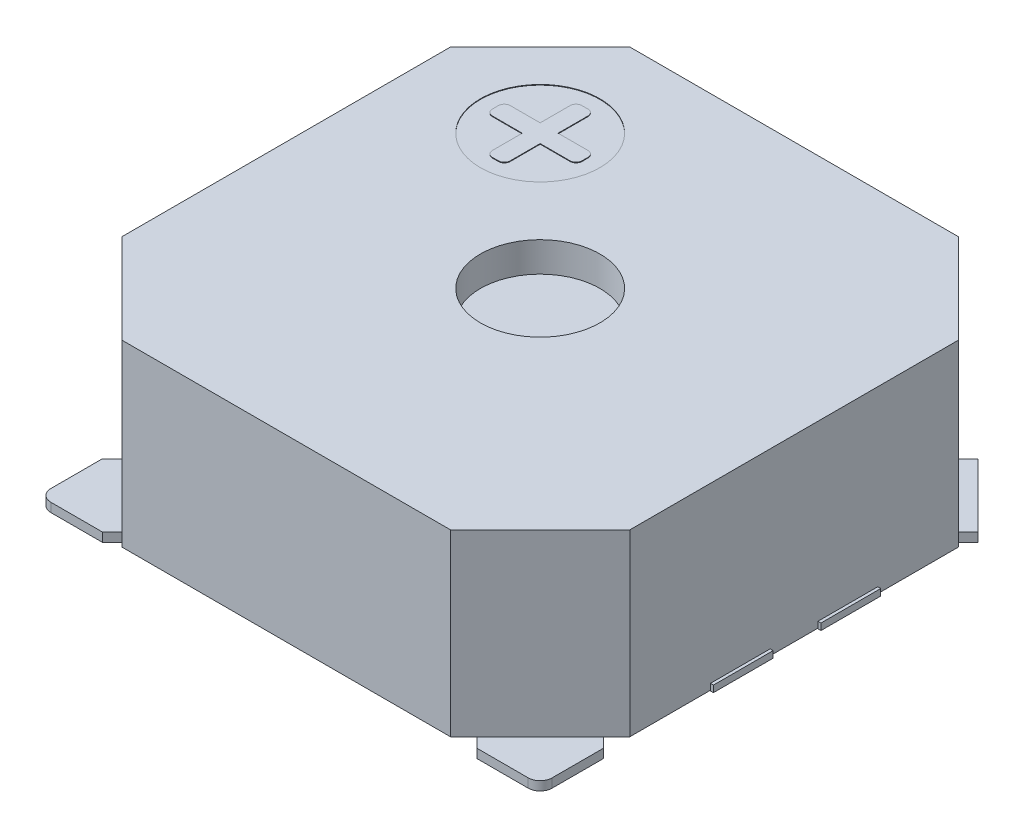
from build123d import *

# Parameters (mm, degrees)
SKETCH1_W                = 8.5
SKETCH1_H                = 8.5
BOSS_EXTRUDE1_DEPTH      = 3
CUT_EXTRUDE1_DEPTH       = 3
SHELL2_T                 = 0.5
SKETCH3_R                = 1
CUT_EXTRUDE2_DEPTH       = 0.5
BOSS_EXTRUDE2_DEPTH      = 0.15
SKETCH5_R                = 1
CUT_EXTRUDE3_DEPTH       = 0.01
BOSS_EXTRUDE3_DEPTH      = 0.01
BOSS_EXTRUDE3_DEPTH_BACK = 0.1
SKETCH6_W                = 1
SKETCH6_H                = 1
SKETCH7_R                = 0.25
CUT_EXTRUDE4_DEPTH       = 0.1


with BuildPart() as part:
    # Sketch1 → Boss-Extrude1 (new body)
    with BuildSketch(Plane(origin=(0, 0, 0), x_dir=(1, 0, 0), z_dir=(0, 1, 0))):
        Rectangle(SKETCH1_W, SKETCH1_H)
    extrude(amount=BOSS_EXTRUDE1_DEPTH)

    # Sketch2 → Cut-Extrude1 (cut)
    with BuildSketch(Plane(origin=(0, 3, 0), x_dir=(1, 0, 0), z_dir=(0, 1, 0))):
        Polygon((-4.25, 2.75), (-2.75, 4.25), (-4.25, 4.25), align=None)
        Polygon((4.25, 4.25), (4.25, 2.75), (2.75, 4.25), align=None)
        Polygon((4.25, -2.75), (2.75, -4.25), (4.25, -4.25), align=None)
        Polygon((-4.25, -4.25), (-4.25, -2.75), (-2.75, -4.25), align=None)
    extrude(amount=-CUT_EXTRUDE1_DEPTH, mode=Mode.SUBTRACT)

    # Shell2 (no face opened: a closed hollow body)
    add(offset(amount=-SHELL2_T, mode=Mode.PRIVATE), mode=Mode.SUBTRACT)

    # Sketch3 → Cut-Extrude2 (cut)
    with BuildSketch(Plane(origin=(0, 3, 0), x_dir=(1, 0, 0), z_dir=(0, 1, 0))):
        Circle(SKETCH3_R)
    extrude(amount=-CUT_EXTRUDE2_DEPTH, mode=Mode.SUBTRACT)

    # Sketch4 → Boss-Extrude2 (add)
    with BuildSketch(Plane.XZ):
        with BuildLine():
            Line((-4.194600731, 3.13394056), (-3.48749395, 2.426833778))
            Line((-3.48749395, 2.426833778), (-2.426833778, 3.48749395))
            Line((-2.426833778, 3.48749395), (-3.13394056, 4.194600731))
            Line((-3.13394056, 4.194600731), (-3.994600731, 4.194600731))
            ThreePointArc((-3.994600731, 4.194600731), (-4.136022088, 4.136022088), (-4.194600731, 3.994600731))
            Line((-4.194600731, 3.994600731), (-4.194600731, 3.13394056))
        make_face()
        with BuildLine():
            Line((4.194600731, 3.13394056), (4.194600731, 3.994600731))
            ThreePointArc((4.194600731, 3.994600731), (4.136022088, 4.136022088), (3.994600731, 4.194600731))
            Line((3.994600731, 4.194600731), (3.13394056, 4.194600731))
            Line((3.13394056, 4.194600731), (2.426833778, 3.48749395))
            Line((2.426833778, 3.48749395), (3.48749395, 2.426833778))
            Line((3.48749395, 2.426833778), (4.194600731, 3.13394056))
        make_face()
        Polygon((4.194600731, -3.13394056), (3.48749395, -2.426833778), (2.426833778, -3.48749395), (3.13394056, -4.194600731), align=None)
        with BuildLine():
            Line((-4.194600731, -3.13394056), (-4.194600731, -3.994600731))
            ThreePointArc((-4.194600731, -3.994600731), (-4.136022088, -4.136022088), (-3.994600731, -4.194600731))
            Line((-3.994600731, -4.194600731), (-3.13394056, -4.194600731))
            Line((-3.13394056, -4.194600731), (-2.426833778, -3.48749395))
            Line((-2.426833778, -3.48749395), (-3.48749395, -2.426833778))
            Line((-3.48749395, -2.426833778), (-4.194600731, -3.13394056))
        make_face()
    extrude(amount=BOSS_EXTRUDE2_DEPTH)

    # Sketch5 → Cut-Extrude3 (cut)
    with BuildSketch(Plane(origin=(0, 3, 0), x_dir=(1, 0, 0), z_dir=(0, 1, 0))):
        with Locations((-2.25, 2.25)):
            Circle(SKETCH5_R)
        with BuildLine():
            ThreePointArc((-3, 2.3), (-2.970710678, 2.370710678), (-2.9, 2.4))
            Line((-2.9, 2.4), (-2.4, 2.4))
            Line((-2.4, 2.4), (-2.4, 2.9))
            ThreePointArc((-2.4, 2.9), (-2.370710678, 2.970710678), (-2.3, 3))
            Line((-2.3, 3), (-2.2, 3))
            ThreePointArc((-2.2, 3), (-2.129289322, 2.970710678), (-2.1, 2.9))
            Line((-2.1, 2.9), (-2.1, 2.4))
            Line((-2.1, 2.4), (-1.6, 2.4))
            ThreePointArc((-1.6, 2.4), (-1.529289322, 2.370710678), (-1.5, 2.3))
            Line((-1.5, 2.3), (-1.5, 2.2))
            ThreePointArc((-1.5, 2.2), (-1.529289322, 2.129289322), (-1.6, 2.1))
            Line((-1.6, 2.1), (-2.1, 2.1))
            Line((-2.1, 2.1), (-2.1, 1.6))
            ThreePointArc((-2.1, 1.6), (-2.129289322, 1.529289322), (-2.2, 1.5))
            Line((-2.2, 1.5), (-2.3, 1.5))
            ThreePointArc((-2.3, 1.5), (-2.370710678, 1.529289322), (-2.4, 1.6))
            Line((-2.4, 1.6), (-2.4, 2.1))
            Line((-2.4, 2.1), (-2.9, 2.1))
            ThreePointArc((-2.9, 2.1), (-2.970710678, 2.129289322), (-3, 2.2))
            Line((-3, 2.2), (-3, 2.3))
        make_face(mode=Mode.SUBTRACT)
    extrude(amount=-CUT_EXTRUDE3_DEPTH, mode=Mode.SUBTRACT)

    # Sketch6 → Boss-Extrude3 (add, two sides: drawn at the far end of the back side and taken through both)
    with BuildSketch(Plane.XZ.offset(-BOSS_EXTRUDE3_DEPTH_BACK)):
        with Locations((3.8, 0.9)):
            Rectangle(SKETCH6_W, SKETCH6_H)
        with Locations((3.8, -0.9)):
            Rectangle(SKETCH6_W, SKETCH6_H)
    extrude(amount=BOSS_EXTRUDE3_DEPTH + BOSS_EXTRUDE3_DEPTH_BACK)

    # Sketch7 → Cut-Extrude4 (cut)
    with BuildSketch(Plane.XZ):
        with Locations((0, 2.8)):
            Circle(SKETCH7_R)
        with Locations((0, -2.8)):
            Circle(SKETCH7_R)
    extrude(amount=-CUT_EXTRUDE4_DEPTH, mode=Mode.SUBTRACT)


solid = part.part
